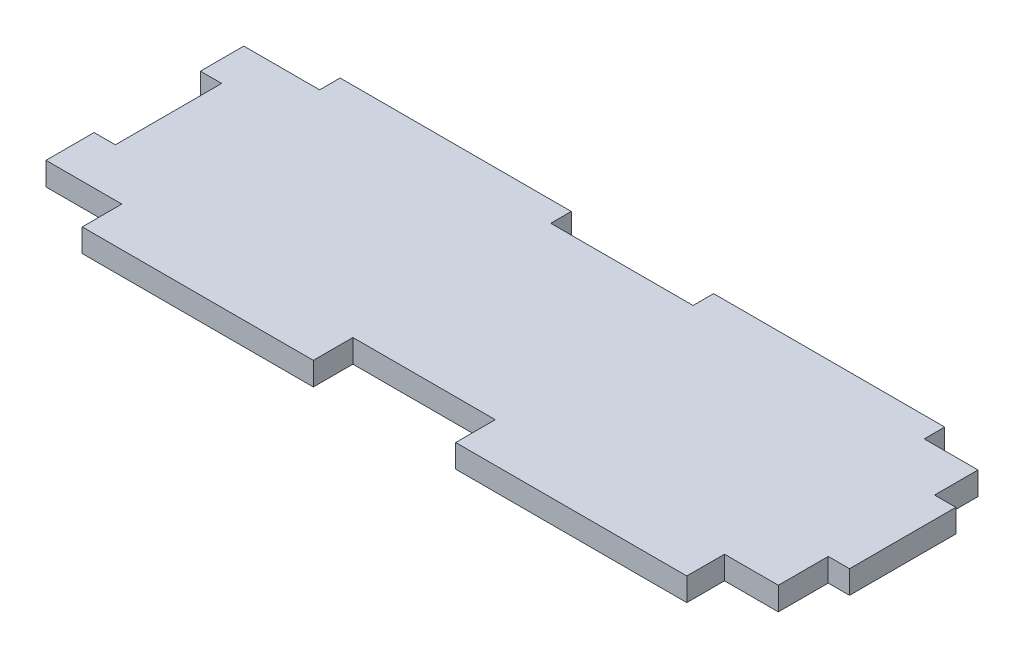
from build123d import *

# Parameters (mm, degrees)
BOSS_EXTRUDE1_DEPTH = 1.5875
SKETCH2_W           = 10.414
SKETCH2_H           = 0.635
SKETCH2_W_2         = 19.558
SKETCH2_W_3         = 7.3914
SKETCH2_H_2         = 0.889
CUT_EXTRUDE1_DEPTH  = 56.607220803
SKETCH3_W           = 31.75
SKETCH3_H           = 0.635
CUT_EXTRUDE3_DEPTH  = 56.607220803


with BuildPart() as part:
    # Sketch1 → Boss-Extrude1 (new, symmetric)
    with BuildSketch(Plane(origin=(0, 0, 0), x_dir=(1, 0, 0), z_dir=(0, 1, 0))):
        Polygon((-49.022, -7.3025), (-49.022, 7.3025), (-51.943, 7.3025), (-51.943, 13.9065), (-41.529, 13.9065), (-41.529, 16.7259), (-9.779, 16.7259), (-9.779, 13.9065), (9.779, 13.9065), (9.779, 16.7259), (41.529, 16.7259), (41.529, 14.1605), (48.9204, 14.1605), (48.9204, 7.3025), (51.8414, 7.3025), (51.8414, -7.3025), (48.9204, -7.3025), (48.9204, -14.1605), (41.529, -14.1605), (41.527983985, -19.596099905), (9.779, -19.3421), (9.779, -13.9065), (-9.779, -13.9065), (-9.779, -19.3421), (-41.529, -19.3421), (-41.529, -13.9065), (-51.943, -13.9065), (-51.943, -7.3025), align=None)
    extrude(amount=BOSS_EXTRUDE1_DEPTH, both=True)

    # Sketch2 → Cut-Extrude1 (cut, through all)
    with BuildSketch(Plane(origin=(0, 1.5875, 0), x_dir=(1, 0, 0), z_dir=(0, 1, 0))):
        with Locations((-46.736, 13.589)):
            Rectangle(SKETCH2_W, SKETCH2_H)
        with Locations((0, 13.589)):
            Rectangle(SKETCH2_W_2, SKETCH2_H)
        with Locations((45.2247, 13.716)):
            Rectangle(SKETCH2_W_3, SKETCH2_H_2)
    extrude(amount=-CUT_EXTRUDE1_DEPTH, mode=Mode.SUBTRACT)

    # Sketch3 → Cut-Extrude3 (cut, through all)
    with BuildSketch(Plane(origin=(0, 1.5875, 0), x_dir=(1, 0, 0), z_dir=(0, 1, 0))):
        with Locations((-25.654, 16.4084)):
            Rectangle(SKETCH3_W, SKETCH3_H)
        Polygon((9.779, -19.3421), (41.528031462, -19.3421), (41.527983985, -19.596099905), (9.779096987, -19.596099905), align=None)
        with Locations((25.654, 16.4084)):
            Rectangle(SKETCH3_W, SKETCH3_H)
    extrude(amount=-CUT_EXTRUDE3_DEPTH, mode=Mode.SUBTRACT)


solid = part.part
